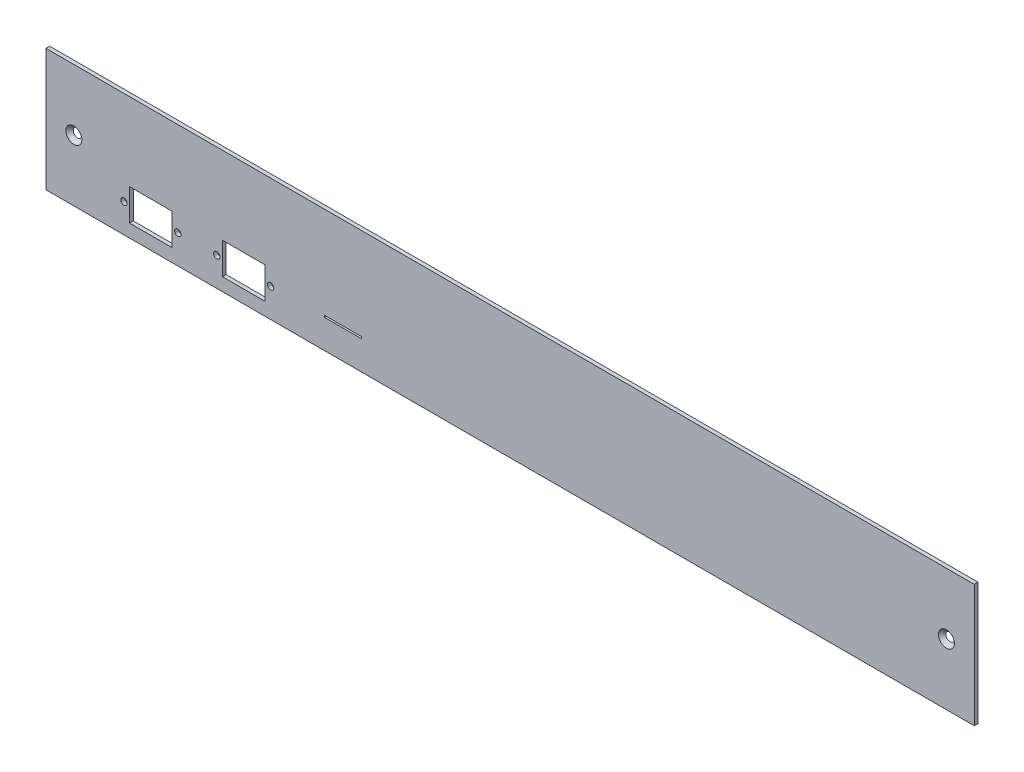
from build123d import *

# Parameters (mm, degrees)
AUFSATZ_LINEAR_AUSTRAGEN1_DEPTH             = 2
FORMSENKUNG_F_R_M4_SENKSCHRAUBE_MIT_2_COUNT = 2
FORMSENKUNG_F_R_M4_SENKSCHRAUBE_MIT_2_PITCH = 470
SKIZZE4_R                                   = 1.7
SKIZZE4_W                                   = 23
SKIZZE4_H                                   = 17
SKIZZE4_W_2                                 = 20
SKIZZE4_H_2                                 = 1
SCHNITT_LINEAR_AUSTRAGEN1_DEPTH             = 10
SKIZZE7_W                                   = 500
SKIZZE7_H                                   = 8
SCHNITT_LINEAR_AUSTRAGEN3_DEPTH             = 10


with BuildPart() as part:
    # Skizze1 → Aufsatz-Linear austragen1 (new body)
    with BuildSketch(Plane.XY):
        Polygon((-339.903846154, 3), (160.096153846, 3), (160.096153846, -63), (130.094653846, -63), (130.094653846, -71), (-309.902346154, -71), (-309.902346154, -63), (-316.903846154, -63), (-339.903846154, -63), align=None)
    extrude(amount=AUFSATZ_LINEAR_AUSTRAGEN1_DEPTH)

    # Skizze3 → Formsenkung für M4 Senkschraube mit Innensechskant1 (revolve, cut)
    with BuildSketch(Plane(origin=(145.096153846, -30, 2), x_dir=(0, -1, 0), z_dir=(1, 0, 0))):
        Polygon((0, 0), (0, 2), (2.25, 2), (2.25, 2.05), (4.3, 0), align=None)
    formsenkung_f_r_m4_senkschraube_mit_inne = revolve(axis=Axis((145.096153846, -30, 8.35), (0, 0, -1)), mode=Mode.SUBTRACT)

    # Formsenkung f_r M4 Senkschraube mit  2: Formsenkung für M4 Senkschraube mit Innensechskant1 ×2
    with Locations(*[(-i * FORMSENKUNG_F_R_M4_SENKSCHRAUBE_MIT_2_PITCH, 0, 0) for i in range(1, FORMSENKUNG_F_R_M4_SENKSCHRAUBE_MIT_2_COUNT)]):
        add(formsenkung_f_r_m4_senkschraube_mit_inne, mode=Mode.SUBTRACT)

    # Skizze4 → Schnitt-Linear austragen1 (cut)
    with BuildSketch(Plane.XY.offset(2)):
        with Locations((-268.903846154, -47.5)):
            Circle(SKIZZE4_R)
        with Locations((-297.903846154, -47.5)):
            Circle(SKIZZE4_R)
        with Locations((-218.903846154, -47.5)):
            Circle(SKIZZE4_R)
        with Locations((-247.903846154, -47.5)):
            Circle(SKIZZE4_R)
        with Locations((-283.403846154, -47.5)):
            Rectangle(SKIZZE4_W, SKIZZE4_H)
        with Locations((-179.903846154, -47)):
            Rectangle(SKIZZE4_W_2, SKIZZE4_H_2)
        with Locations((-233.403846154, -47.5)):
            Rectangle(SKIZZE4_W, SKIZZE4_H)
    extrude(amount=-SCHNITT_LINEAR_AUSTRAGEN1_DEPTH, mode=Mode.SUBTRACT)

    # Skizze7 → Schnitt-Linear austragen3 (cut)
    with BuildSketch(Plane(origin=(0, 0, 0), x_dir=(-1, 0, 0), z_dir=(0, 0, -1))):
        with Locations((89.903846154, -67)):
            Rectangle(SKIZZE7_W, SKIZZE7_H)
    extrude(amount=-SCHNITT_LINEAR_AUSTRAGEN3_DEPTH, mode=Mode.SUBTRACT)


solid = part.part
